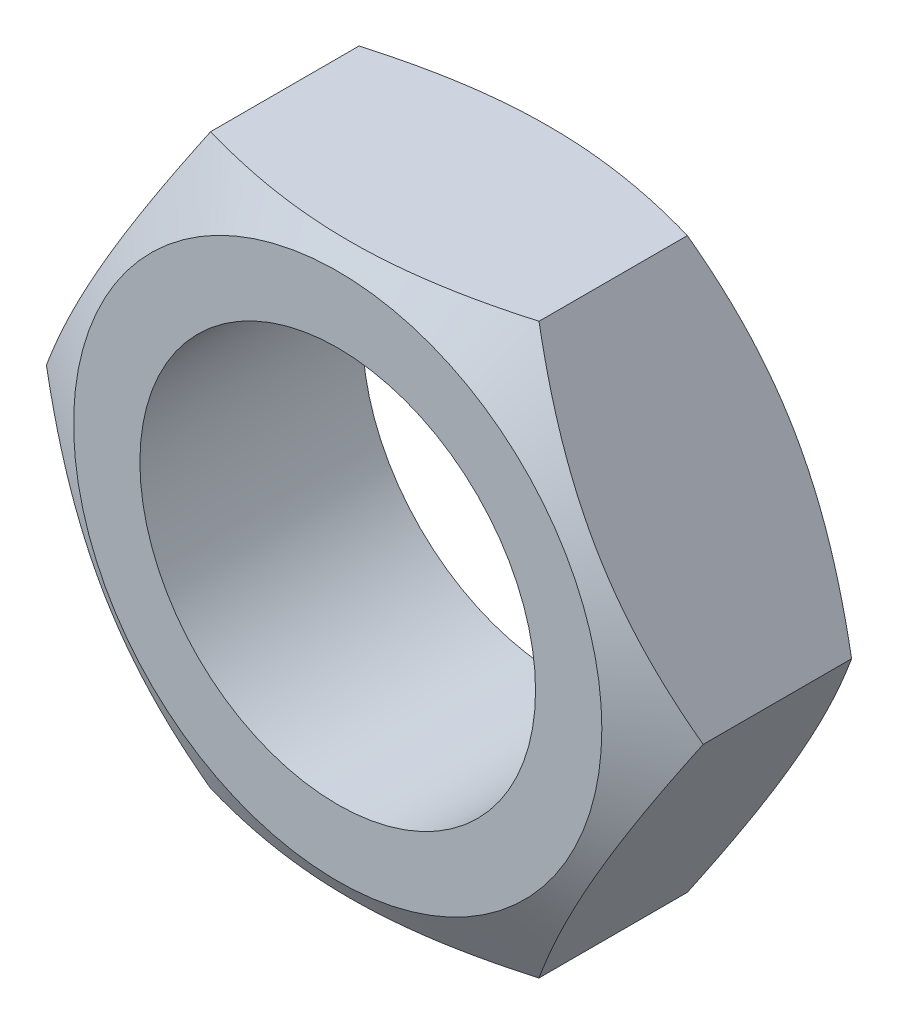
from build123d import *

# Parameters (mm, degrees)
EXTRUDE_1_DEPTH = 18
M20X2_5_1_D     = 32
M20X2_5_1_DEPTH = 47.5
M20X2_5_1_TIP   = 9.613769904


with BuildPart() as part:
    # 草图1 → 拉伸1 (new body)
    with BuildSketch(Plane.XY):
        Polygon((26.558112383, 0), (13.279056191, 23), (-13.279056191, 23), (-26.558112383, 0), (-13.279056191, -23), (13.279056191, -23), align=None)
    extrude(amount=EXTRUDE_1_DEPTH)

    # 草图2 → 切除-旋转1 (revolve, cut)
    with BuildSketch(Plane(origin=(0, 0, 0), x_dir=(1, 0, 0), z_dir=(0, 1, 0))):
        Polygon((4.209845782, 9.902777738), (26.558112383, -3), (32.141291251, 6.670349468), align=None)
        Polygon((26.558112383, -15), (32.141291251, -24.670349468), (4.209845782, -27.902777738), align=None)
    revolve(axis=Axis((0, 0, -13.306273389), (0, 0, 1)), mode=Mode.SUBTRACT)

    # M20x2.5 螺纹孔1
    with Locations(Plane.XY.offset(18)):
        with Locations((0, 0)):
            Hole(M20X2_5_1_D / 2, depth=M20X2_5_1_DEPTH)
            with Locations((0, 0, -(M20X2_5_1_DEPTH + M20X2_5_1_TIP / 2))):  # 118° drill point
                Cone(0, M20X2_5_1_D / 2, M20X2_5_1_TIP, mode=Mode.SUBTRACT)


solid = part.part
